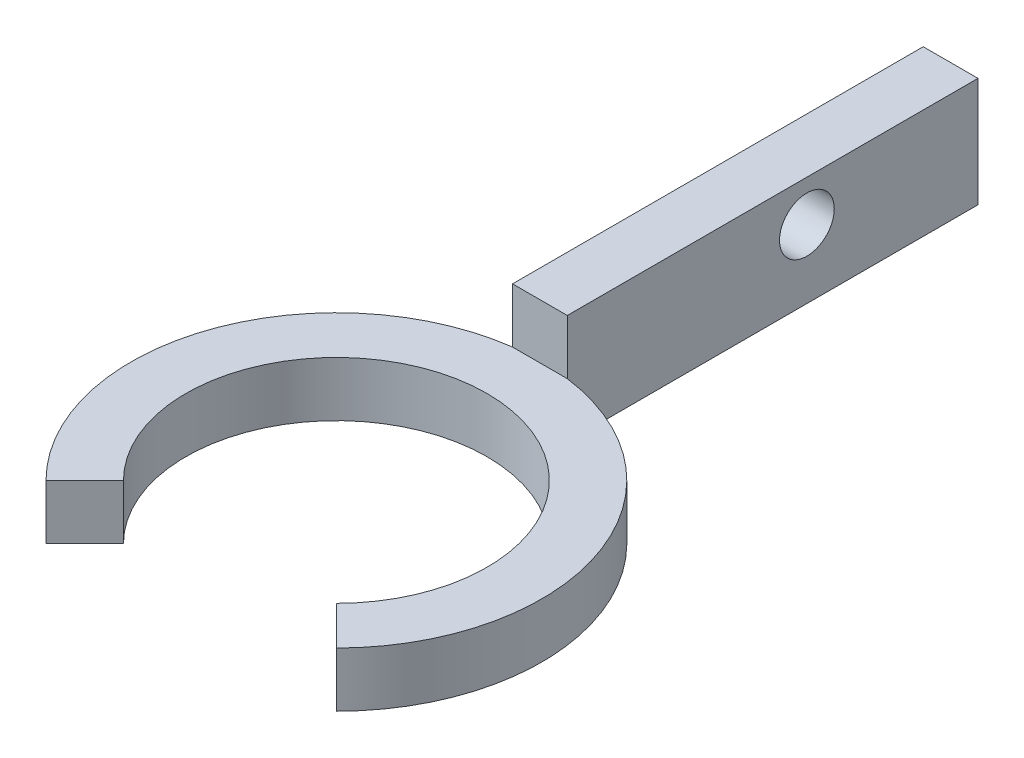
from build123d import *

# Parameters (mm, degrees)
BOSS_EXTRUDE1_DEPTH      = 2
BOSS_EXTRUDE2_DEPTH      = 2
BOSS_EXTRUDE2_DEPTH_BACK = 2
SKETCH2_W                = 2
SKETCH2_H                = 15
SKETCH3_R                = 1
CUT_EXTRUDE1_DEPTH       = 25.320588628


with BuildPart() as part:
    # Sketch1 → Boss-Extrude1 (new body)
    with BuildSketch(Plane(origin=(0, 0, 0), x_dir=(1, 0, 0), z_dir=(0, 1, 0))):
        with BuildLine():
            Line((3.889087297, -3.889087297), (5.303300859, -5.303300859))
            ThreePointArc((5.303300859, -5.303300859), (0, 7.5), (-5.303300859, -5.303300859))
            Line((-5.303300859, -5.303300859), (-3.889087297, -3.889087297))
            ThreePointArc((-3.889087297, -3.889087297), (0, 5.5), (3.889087297, -3.889087297))
        make_face()
    extrude(amount=BOSS_EXTRUDE1_DEPTH)

    # Sketch2 → Boss-Extrude2 (add, two sides: drawn at the far end of the back side and taken through both)
    with BuildSketch(Plane(origin=(0, 2, 0), x_dir=(1, 0, 0), z_dir=(0, 1, 0)).offset(-BOSS_EXTRUDE2_DEPTH_BACK)):
        with Locations((0, 14.933034374)):
            Rectangle(SKETCH2_W, SKETCH2_H)
    extrude(amount=BOSS_EXTRUDE2_DEPTH + BOSS_EXTRUDE2_DEPTH_BACK)

    # Sketch3 → Cut-Extrude1 (cut, through all)
    with BuildSketch(Plane(origin=(1, 0, 0), x_dir=(0, 0, -1), z_dir=(1, 0, 0))):
        with Locations((16.183034374, 2.5)):
            Circle(SKETCH3_R)
    extrude(amount=-CUT_EXTRUDE1_DEPTH, mode=Mode.SUBTRACT)


solid = part.part
